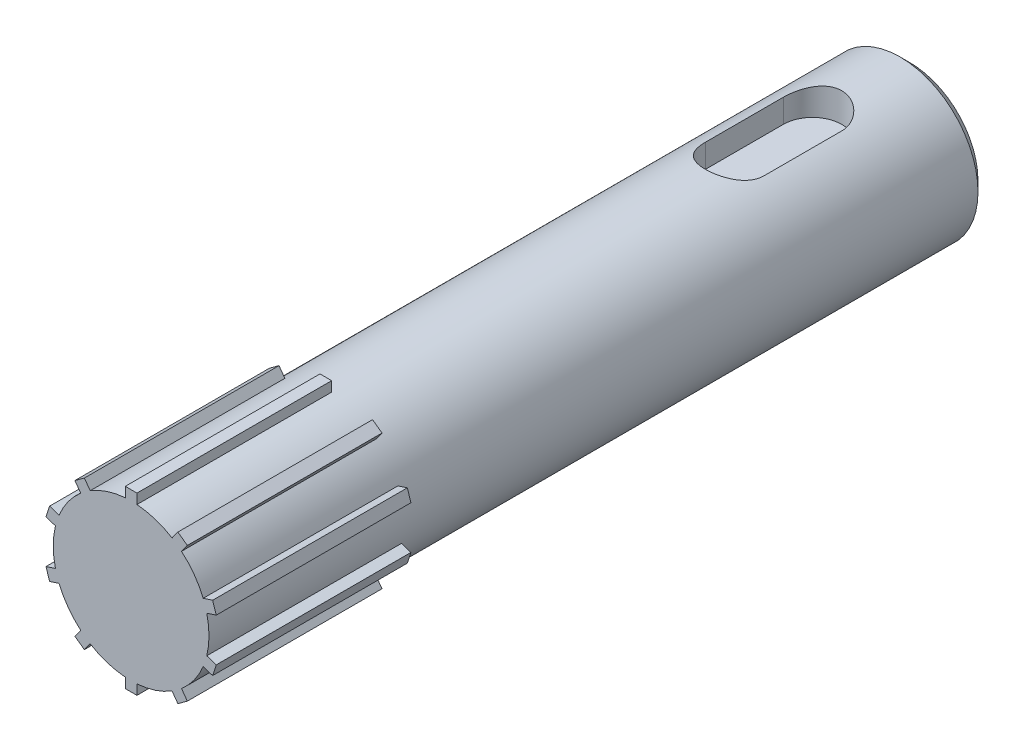
from build123d import *

# Parameters (mm, degrees)
SKETCH1_R           = 4
BOSS_EXTRUDE1_DEPTH = 40
CUT_EXTRUDE1_START  = 2.5
CUT_EXTRUDE1_DEPTH  = 38.898019753
SKETCH3_W           = 0.6
SKETCH3_H           = 2.5
BOSS_EXTRUDE2_DEPTH = 10
CIRPATTERN1_COUNT   = 10
CHAMFER1_SIZE       = 0.5


with BuildPart() as part:
    # Sketch1 → Boss-Extrude1 (new body)
    with BuildSketch(Plane.XY):
        Circle(SKETCH1_R)
    extrude(amount=BOSS_EXTRUDE1_DEPTH)

    # Sketch2 → Cut-Extrude1 (cut, through all)
    with BuildSketch(Plane(origin=(0, 0, 0), x_dir=(1, 0, 0), z_dir=(0, 1, 0)).offset(CUT_EXTRUDE1_START)):
        with BuildLine():
            Line((-1.5, -9), (-1.5, -5))
            ThreePointArc((-1.5, -5), (0, -3.5), (1.5, -5))
            Line((1.5, -5), (1.5, -9))
            ThreePointArc((1.5, -9), (0, -10.5), (-1.5, -9))
        make_face()
    extrude(amount=CUT_EXTRUDE1_DEPTH, mode=Mode.SUBTRACT)

    # Sketch3 → Boss-Extrude2 (add)
    with BuildSketch(Plane.XY.offset(40)):
        with Locations((0, 3.25)):
            Rectangle(SKETCH3_W, SKETCH3_H)
    boss_extrude2 = extrude(amount=-BOSS_EXTRUDE2_DEPTH)

    # CirPattern1: Boss-Extrude2 ×10 about axis
    cirpattern1_axis = Axis((0, 0, 0), (0, 0, 1))
    for i in range(1, CIRPATTERN1_COUNT):
        add(boss_extrude2.rotate(cirpattern1_axis, i * 360 / CIRPATTERN1_COUNT))

    # Chamfer1
    chamfer1_edges = [part.edges().sort_by_distance(p)[0] for p in [
        (-4, 0, 0),
    ]]
    chamfer(chamfer1_edges, length=CHAMFER1_SIZE)


solid = part.part
